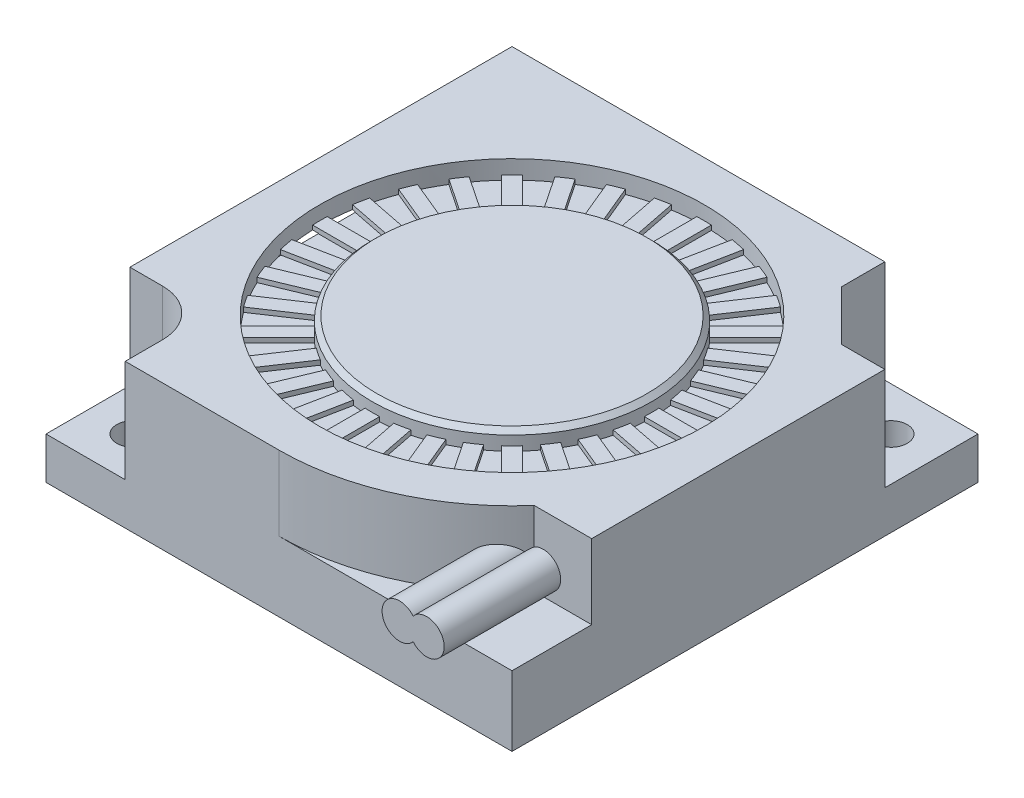
from build123d import *

# Parameters (mm, degrees)
SKETCH_1_W          = 20
SKETCH_1_H          = 20
EXTRUDE_1_DEPTH     = 6.2
CUT_EXTRUDE_1_REACH = 17.442
SKETCH_2_R          = 0.7
SKETCH_3_R          = 0.7
CUT_EXTRUDE_2_DEPTH = 4.4
CUT_EXTRUDE_3_DEPTH = 3.2
CUT_EXTRUDE_4_DEPTH = 0.8
EXTRUDE_START       = 0.2
EXTRUDE_2_DEPTH     = 0.2
CHAMFER_1_SIZE      = 0.2
SKETCH_7_W          = 14.623886009
SKETCH_7_H          = 4.51554906
CUT_EXTRUDE_5_DEPTH = 2
EXTRUDE_3_DEPTH     = 5


with BuildPart() as part:
    # 草图1 → 凸台-拉伸1 (new body)
    with BuildSketch(Plane(origin=(0, 0, 0), x_dir=(1, 0, 0), z_dir=(0, 1, 0))):
        Rectangle(SKETCH_1_W, SKETCH_1_H)
    extrude(amount=EXTRUDE_1_DEPTH)

    # 草图2 → 切除-拉伸1 (cut, up to next)
    with BuildSketch(Plane(origin=(0, 6.2, 0), x_dir=(1, 0, 0), z_dir=(0, 1, 0)), mode=Mode.PRIVATE) as cut_extrude_1_sk1:
        with Locations(Location((-8.131727984, -8.131727984, 0), (0, 0, 270))):
            Circle(SKETCH_2_R)
    cut_extrude_1_tool1 = extrude(cut_extrude_1_sk1.sketch, amount=-CUT_EXTRUDE_1_REACH, mode=Mode.PRIVATE) & part.part
    # 草图2 → 切除-拉伸1 (cut, up to next)
    with BuildSketch(Plane(origin=(0, 6.2, 0), x_dir=(1, 0, 0), z_dir=(0, 1, 0)), mode=Mode.PRIVATE) as cut_extrude_1_sk2:
        with Locations(Location((8.131727984, 8.131727984, 0), (0, 0, 270))):
            Circle(SKETCH_2_R)
    cut_extrude_1_tool2 = extrude(cut_extrude_1_sk2.sketch, amount=-CUT_EXTRUDE_1_REACH, mode=Mode.PRIVATE) & part.part
    add(cut_extrude_1_tool1.solids().sort_by_distance((-8.131728, 6.2, 8.131728))[0], mode=Mode.SUBTRACT)
    add(cut_extrude_1_tool2.solids().sort_by_distance((8.131728, 6.2, -8.131728))[0], mode=Mode.SUBTRACT)

    # 草图3 → 切除-拉伸2 (cut)
    # profile 1 of 2: a face of its own
    with BuildSketch(Plane(origin=(0, 6.2, 0), x_dir=(1, 0, 0), z_dir=(0, 1, 0))):
        with BuildLine():
            Line((-8.6, -6.4), (-10, -6.4))
            Line((-10, -6.4), (-10, -10))
            Line((-10, -10), (-6.6, -10))
            Line((-6.6, -10), (-6.6, -8.4))
            ThreePointArc((-6.6, -8.4), (-7.185786438, -6.985786438), (-8.6, -6.4))
        make_face()
        with Locations(Location((-8.131727984, -8.131727984, 0), (0, 0, 270))):
            Circle(SKETCH_3_R, mode=Mode.SUBTRACT)
    # profile 2 of 2: a face of its own
    with BuildSketch(Plane(origin=(0, 6.2, 0), x_dir=(1, 0, 0), z_dir=(0, 1, 0))):
        Polygon((6, 8.131727984), (6, 10), (10, 10), (10, 8.131727984), (10, 6), (8.131727984, 6), align=None)
        with Locations(Location((8.131727984, 8.131727984, 0), (0, 0, 270))):
            Circle(SKETCH_3_R, mode=Mode.SUBTRACT)
    extrude(amount=-CUT_EXTRUDE_2_DEPTH, mode=Mode.SUBTRACT)

    # 草图4 → 切除-拉伸3 (cut)
    with BuildSketch(Plane(origin=(0, 6.2, 0), x_dir=(1, 0, 0), z_dir=(0, 1, 0))):
        with BuildLine():
            Line((7.531154453, -6.578883841), (10, -6.578883841))
            Line((10, -6.578883841), (10, -10))
            Line((10, -10), (0, -10))
            ThreePointArc((0, -10), (4.135889359, -9.104637236), (7.531154453, -6.578883841))
        make_face()
    extrude(amount=-CUT_EXTRUDE_3_DEPTH, mode=Mode.SUBTRACT)

    # 草图5 → 切除-拉伸4 (cut)
    with BuildSketch(Plane(origin=(0, 6.2, 0), x_dir=(1, 0, 0), z_dir=(0, 1, 0))):
        with BuildLine():
            Line((0, 8.25), (0, 6))
            ThreePointArc((0, 6), (0.156809938, 5.997950537), (0.31351275, 5.991803548))
            Line((0.31351275, 5.991803548), (0.31351275, 8.244040863))
            ThreePointArc((0.31351275, 8.244040863), (0.15678469, 8.248510081), (0, 8.25))
        make_face()
        with BuildLine():
            ThreePointArc((6, 0), (4.242640687, -4.242640687), (0, -6))
            Line((0, -6), (0, -8.25))
            ThreePointArc((0, -8.25), (5.833630945, -5.833630945), (8.25, 0))
            ThreePointArc((8.25, 0), (5.943440931, 5.721713896), (0.31351275, 8.244040863))
            Line((0.31351275, 8.244040863), (0.31351275, 5.991803548))
            ThreePointArc((0.31351275, 5.991803548), (4.352072868, 4.130310128), (6, 0))
        make_face()
        with BuildLine():
            ThreePointArc((0, -6), (-5.997950537, -0.156809938), (-0.31351275, 5.991803548))
            Line((-0.31351275, 5.991803548), (-0.31351275, 8.244040863))
            ThreePointArc((-0.31351275, 8.244040863), (-8.248510081, -0.15678469), (0, -8.25))
            Line((0, -8.25), (0, -6))
        make_face()
        with BuildLine():
            Line((-0.31351275, 8.244040863), (-0.31351275, 5.991803548))
            ThreePointArc((-0.31351275, 5.991803548), (-0.156809938, 5.997950537), (0, 6))
            Line((0, 6), (0, 8.25))
            ThreePointArc((0, 8.25), (-0.15678469, 8.248510081), (-0.31351275, 8.244040863))
        make_face()
    extrude(amount=-CUT_EXTRUDE_4_DEPTH, mode=Mode.SUBTRACT)

    # 草图6 → 凸台-拉伸2 (add)
    with BuildSketch(Plane(origin=(0, 5.4, 0), x_dir=(1, 0, 0), z_dir=(0, 1, 0)).offset(EXTRUDE_START)):
        with BuildLine():
            Line((0.31351275, 5.991803548), (0.31351275, 8.244040863))
            ThreePointArc((0.31351275, 8.244040863), (0, 8.25), (-0.31351275, 8.244040863))
            Line((-0.31351275, 8.244040863), (-0.31351275, 5.991803548))
            ThreePointArc((-0.31351275, 5.991803548), (0, 6), (0.31351275, 5.991803548))
        make_face()
        with BuildLine():
            Line((1.476431574, 5.815509419), (1.915821277, 8.024470626))
            ThreePointArc((1.915821277, 8.024470626), (1.609495157, 8.091478563), (1.300843896, 8.146797233))
            Line((1.300843896, 8.146797233), (0.861454193, 5.937836026))
            ThreePointArc((0.861454193, 5.937836026), (1.170541932, 5.884711682), (1.476431574, 5.815509419))
        make_face()
        with BuildLine():
            Line((2.582611961, 5.415728525), (3.444505867, 7.496524483))
            ThreePointArc((3.444505867, 7.496524483), (3.157138317, 7.622006143), (2.865209841, 7.736476754))
            Line((2.865209841, 7.736476754), (2.003315935, 5.655680796))
            ThreePointArc((2.003315935, 5.655680796), (2.296100594, 5.543277195), (2.582611961, 5.415728525))
        make_face()
        with BuildLine():
            Line((3.589544018, 4.807824221), (4.840820028, 6.680491109))
            ThreePointArc((4.840820028, 6.680491109), (4.583454422, 6.859624301), (4.319467379, 7.028847812))
            Line((4.319467379, 7.028847812), (3.068191368, 5.156180925))
            ThreePointArc((3.068191368, 5.156180925), (3.333421398, 4.988817674), (3.589544018, 4.807824221))
        make_face()
        with BuildLine():
            Line((4.458531912, 4.015157929), (6.05110419, 5.607730207))
            ThreePointArc((6.05110419, 5.607730207), (5.833630945, 5.833630945), (5.607730207, 6.05110419))
            Line((5.607730207, 6.05110419), (4.015157929, 4.458531912))
            ThreePointArc((4.015157929, 4.458531912), (4.242640687, 4.242640687), (4.458531912, 4.015157929))
        make_face()
        with BuildLine():
            Line((5.156180925, 3.068191368), (7.028847812, 4.319467379))
            ThreePointArc((7.028847812, 4.319467379), (6.859624301, 4.583454422), (6.680491109, 4.840820028))
            Line((6.680491109, 4.840820028), (4.807824221, 3.589544018))
            ThreePointArc((4.807824221, 3.589544018), (4.988817674, 3.333421398), (5.156180925, 3.068191368))
        make_face()
        with BuildLine():
            Line((5.655680796, 2.003315935), (7.736476754, 2.865209841))
            ThreePointArc((7.736476754, 2.865209841), (7.622006143, 3.157138317), (7.496524483, 3.444505867))
            Line((7.496524483, 3.444505867), (5.415728525, 2.582611961))
            ThreePointArc((5.415728525, 2.582611961), (5.543277195, 2.296100594), (5.655680796, 2.003315935))
        make_face()
        with BuildLine():
            Line((5.937836026, 0.861454193), (8.146797233, 1.300843896))
            ThreePointArc((8.146797233, 1.300843896), (8.091478563, 1.609495157), (8.024470626, 1.915821277))
            Line((8.024470626, 1.915821277), (5.815509419, 1.476431574))
            ThreePointArc((5.815509419, 1.476431574), (5.884711682, 1.170541932), (5.937836026, 0.861454193))
        make_face()
        with BuildLine():
            Line((5.991803548, -0.31351275), (8.244040863, -0.31351275))
            ThreePointArc((8.244040863, -0.31351275), (8.25, 0), (8.244040863, 0.31351275))
            Line((8.244040863, 0.31351275), (5.991803548, 0.31351275))
            ThreePointArc((5.991803548, 0.31351275), (6, 0), (5.991803548, -0.31351275))
        make_face()
        with BuildLine():
            Line((5.815509419, -1.476431574), (8.024470626, -1.915821277))
            ThreePointArc((8.024470626, -1.915821277), (8.091478563, -1.609495157), (8.146797233, -1.300843896))
            Line((8.146797233, -1.300843896), (5.937836026, -0.861454193))
            ThreePointArc((5.937836026, -0.861454193), (5.884711682, -1.170541932), (5.815509419, -1.476431574))
        make_face()
        with BuildLine():
            Line((5.415728525, -2.582611961), (7.496524483, -3.444505867))
            ThreePointArc((7.496524483, -3.444505867), (7.622006143, -3.157138317), (7.736476754, -2.865209841))
            Line((7.736476754, -2.865209841), (5.655680796, -2.003315935))
            ThreePointArc((5.655680796, -2.003315935), (5.543277195, -2.296100594), (5.415728525, -2.582611961))
        make_face()
        with BuildLine():
            Line((4.807824221, -3.589544018), (6.680491109, -4.840820028))
            ThreePointArc((6.680491109, -4.840820028), (6.859624301, -4.583454422), (7.028847812, -4.319467379))
            Line((7.028847812, -4.319467379), (5.156180925, -3.068191368))
            ThreePointArc((5.156180925, -3.068191368), (4.988817674, -3.333421398), (4.807824221, -3.589544018))
        make_face()
        with BuildLine():
            Line((4.015157929, -4.458531912), (5.607730207, -6.05110419))
            ThreePointArc((5.607730207, -6.05110419), (5.833630945, -5.833630945), (6.05110419, -5.607730207))
            Line((6.05110419, -5.607730207), (4.458531912, -4.015157929))
            ThreePointArc((4.458531912, -4.015157929), (4.242640687, -4.242640687), (4.015157929, -4.458531912))
        make_face()
        with BuildLine():
            Line((3.068191368, -5.156180925), (4.319467379, -7.028847812))
            ThreePointArc((4.319467379, -7.028847812), (4.583454422, -6.859624301), (4.840820028, -6.680491109))
            Line((4.840820028, -6.680491109), (3.589544018, -4.807824221))
            ThreePointArc((3.589544018, -4.807824221), (3.333421398, -4.988817674), (3.068191368, -5.156180925))
        make_face()
        with BuildLine():
            Line((2.003315935, -5.655680796), (2.865209841, -7.736476754))
            ThreePointArc((2.865209841, -7.736476754), (3.157138317, -7.622006143), (3.444505867, -7.496524483))
            Line((3.444505867, -7.496524483), (2.582611961, -5.415728525))
            ThreePointArc((2.582611961, -5.415728525), (2.296100594, -5.543277195), (2.003315935, -5.655680796))
        make_face()
        with BuildLine():
            Line((0.861454193, -5.937836026), (1.300843896, -8.146797233))
            ThreePointArc((1.300843896, -8.146797233), (1.609495157, -8.091478563), (1.915821277, -8.024470626))
            Line((1.915821277, -8.024470626), (1.476431574, -5.815509419))
            ThreePointArc((1.476431574, -5.815509419), (1.170541932, -5.884711682), (0.861454193, -5.937836026))
        make_face()
        with BuildLine():
            Line((-0.31351275, -5.991803548), (-0.31351275, -8.244040863))
            ThreePointArc((-0.31351275, -8.244040863), (0, -8.25), (0.31351275, -8.244040863))
            Line((0.31351275, -8.244040863), (0.31351275, -5.991803548))
            ThreePointArc((0.31351275, -5.991803548), (0, -6), (-0.31351275, -5.991803548))
        make_face()
        with BuildLine():
            Line((-1.476431574, -5.815509419), (-1.915821277, -8.024470626))
            ThreePointArc((-1.915821277, -8.024470626), (-1.609495157, -8.091478563), (-1.300843896, -8.146797233))
            Line((-1.300843896, -8.146797233), (-0.861454193, -5.937836026))
            ThreePointArc((-0.861454193, -5.937836026), (-1.170541932, -5.884711682), (-1.476431574, -5.815509419))
        make_face()
        with BuildLine():
            Line((-2.582611961, -5.415728525), (-3.444505867, -7.496524483))
            ThreePointArc((-3.444505867, -7.496524483), (-3.157138317, -7.622006143), (-2.865209841, -7.736476754))
            Line((-2.865209841, -7.736476754), (-2.003315935, -5.655680796))
            ThreePointArc((-2.003315935, -5.655680796), (-2.296100594, -5.543277195), (-2.582611961, -5.415728525))
        make_face()
        with BuildLine():
            Line((-3.589544018, -4.807824221), (-4.840820028, -6.680491109))
            ThreePointArc((-4.840820028, -6.680491109), (-4.583454422, -6.859624301), (-4.319467379, -7.028847812))
            Line((-4.319467379, -7.028847812), (-3.068191368, -5.156180925))
            ThreePointArc((-3.068191368, -5.156180925), (-3.333421398, -4.988817674), (-3.589544018, -4.807824221))
        make_face()
        with BuildLine():
            Line((-4.458531912, -4.015157929), (-6.05110419, -5.607730207))
            ThreePointArc((-6.05110419, -5.607730207), (-5.833630945, -5.833630945), (-5.607730207, -6.05110419))
            Line((-5.607730207, -6.05110419), (-4.015157929, -4.458531912))
            ThreePointArc((-4.015157929, -4.458531912), (-4.242640687, -4.242640687), (-4.458531912, -4.015157929))
        make_face()
        with BuildLine():
            Line((-5.156180925, -3.068191368), (-7.028847812, -4.319467379))
            ThreePointArc((-7.028847812, -4.319467379), (-6.859624301, -4.583454422), (-6.680491109, -4.840820028))
            Line((-6.680491109, -4.840820028), (-4.807824221, -3.589544018))
            ThreePointArc((-4.807824221, -3.589544018), (-4.988817674, -3.333421398), (-5.156180925, -3.068191368))
        make_face()
        with BuildLine():
            Line((-5.655680796, -2.003315935), (-7.736476754, -2.865209841))
            ThreePointArc((-7.736476754, -2.865209841), (-7.622006143, -3.157138317), (-7.496524483, -3.444505867))
            Line((-7.496524483, -3.444505867), (-5.415728525, -2.582611961))
            ThreePointArc((-5.415728525, -2.582611961), (-5.543277195, -2.296100594), (-5.655680796, -2.003315935))
        make_face()
        with BuildLine():
            Line((-5.937836026, -0.861454193), (-8.146797233, -1.300843896))
            ThreePointArc((-8.146797233, -1.300843896), (-8.091478563, -1.609495157), (-8.024470626, -1.915821277))
            Line((-8.024470626, -1.915821277), (-5.815509419, -1.476431574))
            ThreePointArc((-5.815509419, -1.476431574), (-5.884711682, -1.170541932), (-5.937836026, -0.861454193))
        make_face()
        with BuildLine():
            Line((-5.991803548, 0.31351275), (-8.244040863, 0.31351275))
            ThreePointArc((-8.244040863, 0.31351275), (-8.25, 0), (-8.244040863, -0.31351275))
            Line((-8.244040863, -0.31351275), (-5.991803548, -0.31351275))
            ThreePointArc((-5.991803548, -0.31351275), (-6, 0), (-5.991803548, 0.31351275))
        make_face()
        with BuildLine():
            Line((-5.815509419, 1.476431574), (-8.024470626, 1.915821277))
            ThreePointArc((-8.024470626, 1.915821277), (-8.091478563, 1.609495157), (-8.146797233, 1.300843896))
            Line((-8.146797233, 1.300843896), (-5.937836026, 0.861454193))
            ThreePointArc((-5.937836026, 0.861454193), (-5.884711682, 1.170541932), (-5.815509419, 1.476431574))
        make_face()
        with BuildLine():
            Line((-5.415728525, 2.582611961), (-7.496524483, 3.444505867))
            ThreePointArc((-7.496524483, 3.444505867), (-7.622006143, 3.157138317), (-7.736476754, 2.865209841))
            Line((-7.736476754, 2.865209841), (-5.655680796, 2.003315935))
            ThreePointArc((-5.655680796, 2.003315935), (-5.543277195, 2.296100594), (-5.415728525, 2.582611961))
        make_face()
        with BuildLine():
            Line((-4.807824221, 3.589544018), (-6.680491109, 4.840820028))
            ThreePointArc((-6.680491109, 4.840820028), (-6.859624301, 4.583454422), (-7.028847812, 4.319467379))
            Line((-7.028847812, 4.319467379), (-5.156180925, 3.068191368))
            ThreePointArc((-5.156180925, 3.068191368), (-4.988817674, 3.333421398), (-4.807824221, 3.589544018))
        make_face()
        with BuildLine():
            Line((-4.015157929, 4.458531912), (-5.607730207, 6.05110419))
            ThreePointArc((-5.607730207, 6.05110419), (-5.833630945, 5.833630945), (-6.05110419, 5.607730207))
            Line((-6.05110419, 5.607730207), (-4.458531912, 4.015157929))
            ThreePointArc((-4.458531912, 4.015157929), (-4.242640687, 4.242640687), (-4.015157929, 4.458531912))
        make_face()
        with BuildLine():
            Line((-3.068191368, 5.156180925), (-4.319467379, 7.028847812))
            ThreePointArc((-4.319467379, 7.028847812), (-4.583454422, 6.859624301), (-4.840820028, 6.680491109))
            Line((-4.840820028, 6.680491109), (-3.589544018, 4.807824221))
            ThreePointArc((-3.589544018, 4.807824221), (-3.333421398, 4.988817674), (-3.068191368, 5.156180925))
        make_face()
        with BuildLine():
            Line((-2.003315935, 5.655680796), (-2.865209841, 7.736476754))
            ThreePointArc((-2.865209841, 7.736476754), (-3.157138317, 7.622006143), (-3.444505867, 7.496524483))
            Line((-3.444505867, 7.496524483), (-2.582611961, 5.415728525))
            ThreePointArc((-2.582611961, 5.415728525), (-2.296100594, 5.543277195), (-2.003315935, 5.655680796))
        make_face()
        with BuildLine():
            Line((-0.861454193, 5.937836026), (-1.300843896, 8.146797233))
            ThreePointArc((-1.300843896, 8.146797233), (-1.609495157, 8.091478563), (-1.915821277, 8.024470626))
            Line((-1.915821277, 8.024470626), (-1.476431574, 5.815509419))
            ThreePointArc((-1.476431574, 5.815509419), (-1.170541932, 5.884711682), (-0.861454193, 5.937836026))
        make_face()
    extrude(amount=-EXTRUDE_2_DEPTH)

    # 倒角1
    chamfer_1_edges = [part.edges().sort_by_distance(p)[0] for p in [
        (0, 6.2, -6),
    ]]
    chamfer(chamfer_1_edges, length=CHAMFER_1_SIZE)

    # 草图7 → 切除-拉伸5 (cut)
    with BuildSketch(Plane.ZY.offset(10)):
        with Locations((-1.726533465, 3.159026785)):
            Rectangle(SKETCH_7_W, SKETCH_7_H)
    extrude(amount=-CUT_EXTRUDE_5_DEPTH, mode=Mode.SUBTRACT)

    # 草图8 → 凸台-拉伸3 (add)
    with BuildSketch(Plane.XY.offset(6.578883841)):
        with BuildLine():
            ThreePointArc((7.336431583, 3.540497479), (8.668631992, 4.013300486), (7.336431583, 4.486103493))
            ThreePointArc((7.336431583, 4.486103493), (6.004231174, 4.013300486), (7.336431583, 3.540497479))
        make_face()
    extrude(amount=EXTRUDE_3_DEPTH)


solid = part.part
